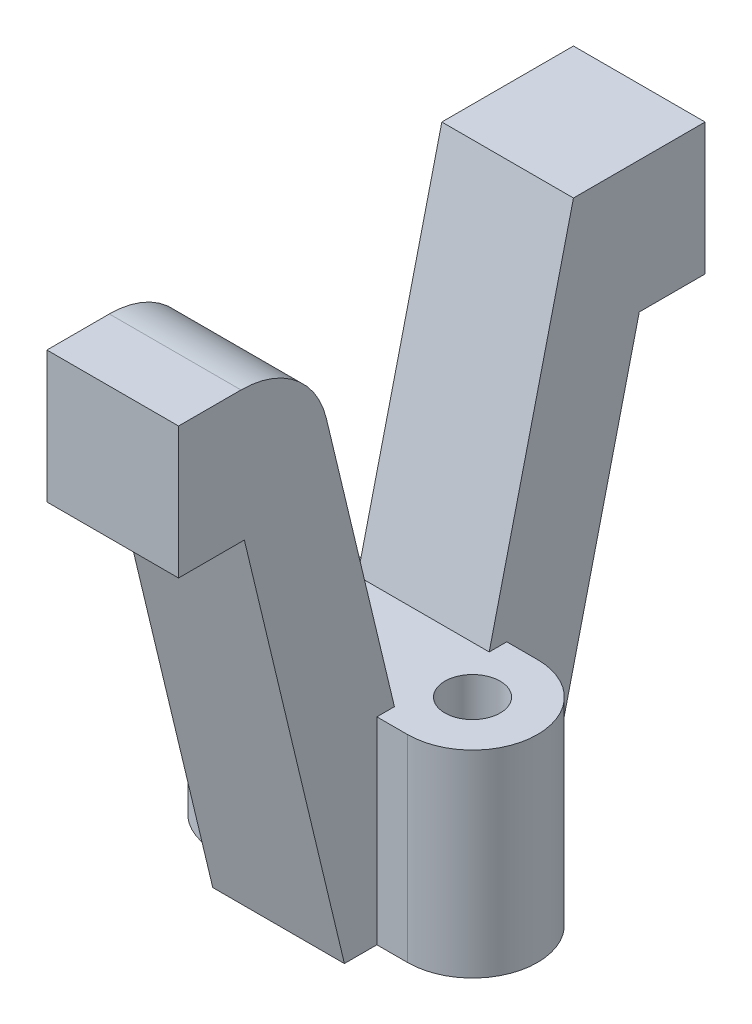
from build123d import *

# Parameters (mm, degrees)
BOSS_EXTRUDE2_DEPTH = 1.5
FILLET1_R           = 2
SKETCH1_R           = 0.63
BOSS_EXTRUDE3_DEPTH = 4.5


with BuildPart() as part:
    # Sketch2 → Boss-Extrude2 (new, symmetric)
    with BuildSketch(Plane(origin=(0, 0, 0), x_dir=(0, 0, -1), z_dir=(1, 0, 0))):
        Polygon((-6, 12.5), (-6, 9.5), (-4.5, 9.5), (-2.22, 0), (0, 0), (-3, 12.5), align=None)
    boss_extrude2 = extrude(amount=BOSS_EXTRUDE2_DEPTH, both=True)

    # Fillet1
    fillet1_edges = [part.edges().sort_by_distance(p)[0] for p in [
        (0, 12.5, 3),
    ]]
    fillet(fillet1_edges, radius=FILLET1_R)

    # Sketch1 → Boss-Extrude3 (add)
    with BuildSketch(Plane(origin=(0, 0, 0), x_dir=(1, 0, 0), z_dir=(0, 1, 0))):
        with BuildLine():
            Line((-2.2, 1.48), (2.2, 1.48))
            ThreePointArc((2.2, 1.48), (3.68, 0), (2.2, -1.48))
            Line((2.2, -1.48), (-2.2, -1.48))
            ThreePointArc((-2.2, -1.48), (-3.68, 0), (-2.2, 1.48))
        make_face()
        with Locations((-2.2, 0)):
            Circle(SKETCH1_R, mode=Mode.SUBTRACT)
        with Locations((2.2, 0)):
            Circle(SKETCH1_R, mode=Mode.SUBTRACT)
    extrude(amount=BOSS_EXTRUDE3_DEPTH)

    # Mirror1: Boss-Extrude2 across plane
    add(boss_extrude2.mirror(Plane.XY))


solid = part.part
